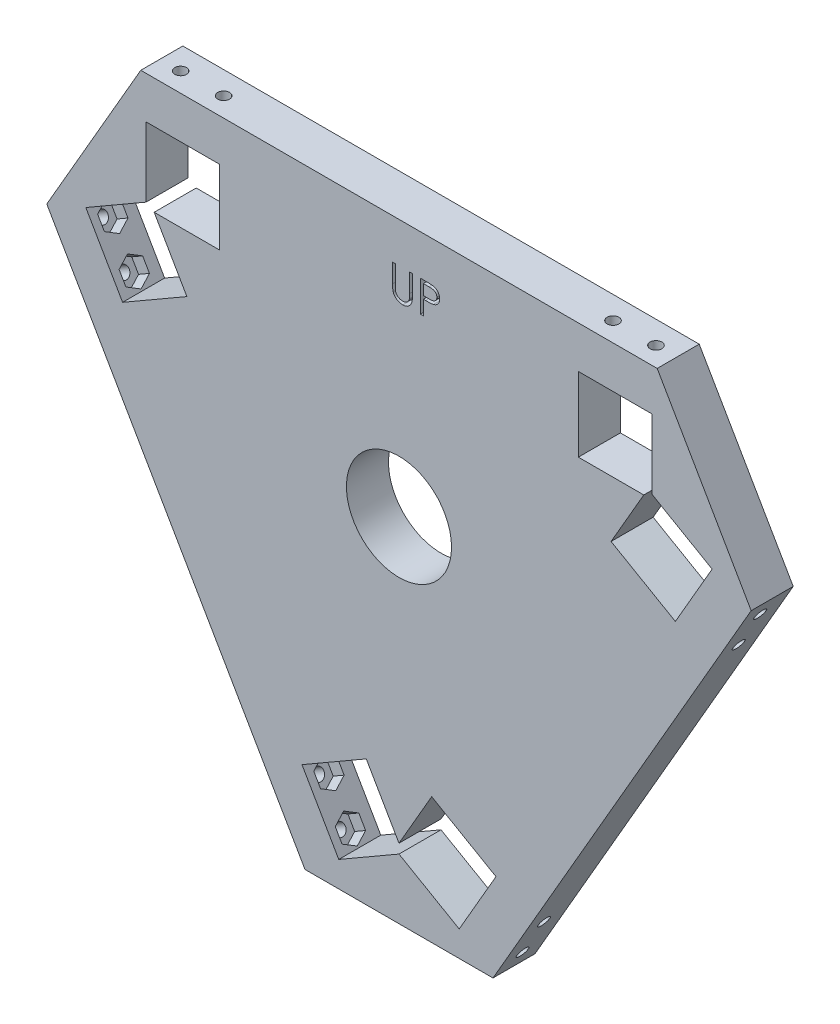
from build123d import *

# Parameters (mm, degrees)
ESBO_O1_R                = 12.5
RESSALTO_EXTRUS_O1_DEPTH = 10
ESBO_O2_R                = 1.4
CORTE_EXTRUS_O1_DEPTH    = 25
CORTE_EXTRUS_O2_START    = -10
CORTE_EXTRUS_O2_DEPTH    = 3
CORTE_EXTRUS_O4_START    = -10
ESBO_O2_6_W              = 10
ESBO_O2_6_H              = 17.5
CORTE_EXTRUS_O4_DEPTH    = 17.66
PADR_OCIRCULAR6_COUNT    = 3
CORTE_EXTRUS_O5_DEPTH    = 2


with BuildPart() as part:
    # Esboço1 → Ressalto-extrusão1 (new body)
    with BuildSketch(Plane.XY):
        Polygon((-61.423008775, 61.28355545), (-83.784620241, 22.552108251), (-22.361611466, -83.835663701), (22.361611466, -83.835663701), (83.784620241, 22.552108251), (61.423008775, 61.28355545), align=None)
        Circle(ESBO_O1_R, mode=Mode.SUBTRACT)
    extrude(amount=RESSALTO_EXTRUS_O1_DEPTH)

    # Esboço2 → Corte-extrusão1 (cut)
    with BuildSketch(Plane(origin=(-53.073115854, -30.641777725, 0), x_dir=(0, 0, 1), z_dir=(-0.8660254037844384, -0.5000000000000006, 0))):
        with Locations((5.4, 56.533008775)):
            Circle(ESBO_O2_R)
        with Locations((5.4, 46.313008775)):
            Circle(ESBO_O2_R)
        with Locations((5.4, -46.313008775)):
            Circle(ESBO_O2_R)
        with Locations((5.4, -56.533008775)):
            Circle(ESBO_O2_R)
    corte_extrus_o1 = extrude(amount=-CORTE_EXTRUS_O1_DEPTH, mode=Mode.SUBTRACT)

    # Esboço2<4> → Corte-extrusão2 (cut)
    with BuildSketch(Plane(origin=(-53.073115854, -30.641777725, 0), x_dir=(0, 0, 1), z_dir=(-0.8660254037844384, -0.5000000000000006, 0)).offset(CORTE_EXTRUS_O2_START)):
        Polygon((8.2, 54.916428021), (8.2, 58.149589529), (5.4, 59.766170282), (2.6, 58.149589529), (2.6, 54.916428021), (5.4, 53.299847267), align=None)
        Polygon((8.2, 44.696428021), (8.2, 47.929589529), (5.4, 49.546170282), (2.6, 47.929589529), (2.6, 44.696428021), (5.4, 43.079847267), align=None)
        Polygon((8.2, -47.929589529), (8.2, -44.696428021), (5.4, -43.079847267), (2.6, -44.696428021), (2.6, -47.929589529), (5.4, -49.546170282), align=None)
        Polygon((8.2, -58.149589529), (8.2, -54.916428021), (5.4, -53.299847267), (2.6, -54.916428021), (2.6, -58.149589529), (5.4, -59.766170282), align=None)
    corte_extrus_o2 = extrude(amount=CORTE_EXTRUS_O2_DEPTH, mode=Mode.SUBTRACT)

    # Esboço2<6> → Corte-extrusão4 (cut)
    with BuildSketch(Plane(origin=(-53.073115854, -30.641777725, 0), x_dir=(0, 0, 1), z_dir=(-0.8660254037844384, -0.5000000000000006, 0)).offset(CORTE_EXTRUS_O4_START)):
        with Locations((5, 51.423008775)):
            Rectangle(ESBO_O2_6_W, ESBO_O2_6_H)
        with Locations((5, -51.423008775)):
            Rectangle(ESBO_O2_6_W, ESBO_O2_6_H)
    corte_extrus_o4 = extrude(amount=-CORTE_EXTRUS_O4_DEPTH, mode=Mode.SUBTRACT)

    # PadrãoCircular6: Corte-extrusão1, Corte-extrusão2, Corte-extrusão4 ×3 about axis
    padr_ocircular6_axis = Axis((0, 0, 10), (0, 0, 1))
    add([corte_extrus_o1.rotate(padr_ocircular6_axis, i * 360 / PADR_OCIRCULAR6_COUNT) for i in range(1, PADR_OCIRCULAR6_COUNT)], mode=Mode.SUBTRACT)
    add([corte_extrus_o2.rotate(padr_ocircular6_axis, i * 360 / PADR_OCIRCULAR6_COUNT) for i in range(1, PADR_OCIRCULAR6_COUNT)], mode=Mode.SUBTRACT)
    add([corte_extrus_o4.rotate(padr_ocircular6_axis, i * 360 / PADR_OCIRCULAR6_COUNT) for i in range(1, PADR_OCIRCULAR6_COUNT)], mode=Mode.SUBTRACT)

    # Esboço3 → Corte-extrusão5 (cut)
    # profile 1 of 2: a face of its own
    with BuildSketch(Plane.XY.offset(10)):
        with BuildLine():
            Line((-1.52797783, 51.712311165), (-0.863127403, 51.712311165))
            Line((-0.863127403, 51.712311165), (-0.863127403, 47.273544138))
            add(Edge.make_bspline(
                [(-0.863127403, 47.273544138), (-0.863226344, 47.210719914), (-0.863414103, 47.091500122), (-0.862159948, 46.921810553), (-0.858647619, 46.770950515), (-0.856433248, 46.638338496), (-0.851507058, 46.524583014), (-0.847489526, 46.429067773), (-0.842323681, 46.352245044), (-0.836115249, 46.307412084), (-0.83344658, 46.288140826)],
                knots=[0, 0, 0, 0, 1.528628734, 2.90083645, 4.128790002, 5.200304208, 6.127813768, 6.898992206, 7.526736466, 8, 8, 8, 8], degree=3))
            add(Edge.make_bspline(
                [(-0.83344658, 46.288140826), (-0.822487626, 46.218615177), (-0.801187215, 46.0834814), (-0.746902382, 45.89105887), (-0.671088671, 45.717637284), (-0.581250898, 45.557805051), (-0.462860204, 45.416010905), (-0.321036054, 45.285387907), (-0.149209777, 45.171147587), (0.041841838, 45.066688369), (0.247762258, 44.982730611), (0.458182771, 44.919244657), (0.669940411, 44.880554319), (0.811706627, 44.876074311), (0.882104969, 44.873849627)],
                knots=[0, 0, 0, 0, 1.035780045, 2.013197591, 2.933192213, 3.817615948, 4.702609284, 5.640816605, 6.646850145, 7.73207398, 8.84249596, 9.914020372, 10.964143139, 12, 12, 12, 12], degree=3))
            add(Edge.make_bspline(
                [(0.882104969, 44.873849627), (0.942543719, 44.87612261), (1.063072142, 44.880655448), (1.242155754, 44.908725477), (1.416569317, 44.959315008), (1.587174089, 45.024592496), (1.74709034, 45.110841564), (1.896407292, 45.210474841), (2.029680953, 45.327337862), (2.151300382, 45.456666924), (2.257207662, 45.602589501), (2.349009912, 45.761928227), (2.424206463, 45.937081011), (2.461340257, 46.060174538), (2.480417268, 46.12341226)],
                knots=[0, 0, 0, 0, 0.994687771, 1.983630487, 2.973142513, 3.978332533, 4.983357753, 5.956394766, 6.925816176, 7.893390482, 8.871859704, 9.88551698, 10.913711441, 12, 12, 12, 12], degree=3))
            add(Edge.make_bspline(
                [(2.480417268, 46.12341226), (2.486767534, 46.149550076), (2.500918484, 46.207795663), (2.514141396, 46.306265728), (2.527913541, 46.422448215), (2.537469381, 46.557177885), (2.546785297, 46.710003277), (2.552358635, 46.881720522), (2.554934688, 47.071706089), (2.555702361, 47.204288082), (2.556103366, 47.273544138)],
                knots=[0, 0, 0, 0, 0.558680831, 1.244966039, 2.062412453, 2.990489873, 4.051219941, 5.244515665, 6.560634259, 8, 8, 8, 8], degree=3))
            Line((2.556103366, 47.273544138), (2.556103366, 51.712311165))
            Line((2.556103366, 51.712311165), (3.220953794, 51.712311165))
            Line((3.220953794, 51.712311165), (3.220953794, 47.237927151))
            add(Edge.make_bspline(
                [(3.220953794, 47.237927151), (3.220415905, 47.157285582), (3.219366184, 46.999908658), (3.210263297, 46.769294948), (3.195749314, 46.550531137), (3.175242861, 46.343587819), (3.148071205, 46.149205516), (3.117855321, 45.965680423), (3.079375309, 45.794329922), (3.034431277, 45.633817971), (2.983052267, 45.481025301), (2.916501836, 45.3360154), (2.841519978, 45.194379921), (2.752588963, 45.058261091), (2.652658203, 44.92705622), (2.539518812, 44.801561011), (2.416912671, 44.67977003), (2.282801604, 44.564807373), (2.139396325, 44.459379007), (1.987123415, 44.366673725), (1.827152585, 44.288307068), (1.659899668, 44.223799694), (1.485293289, 44.175297126), (1.303329044, 44.139154713), (1.113592752, 44.118618183), (0.984550896, 44.115566098), (0.919205997, 44.114020567)],
                knots=[0, 0, 0, 0, 1.316592851, 2.569410997, 3.76748051, 4.895814652, 5.963796859, 6.97159953, 7.931736103, 8.829262218, 9.692595152, 10.560224239, 11.431080259, 12.30701507, 13.211635791, 14.121146779, 15.063487852, 16.031507147, 17.00238618, 17.966455255, 18.938106653, 19.907068911, 20.888905087, 21.893141452, 22.933117798, 24, 24, 24, 24], degree=3))
            add(Edge.make_bspline(
                [(0.919205997, 44.114020567), (0.84793973, 44.115681653), (0.708115569, 44.118940699), (0.502083326, 44.13761552), (0.304568277, 44.172791121), (0.113484338, 44.217579669), (-0.068566981, 44.279351913), (-0.244024772, 44.351526277), (-0.40988398, 44.440166478), (-0.568835336, 44.53878916), (-0.71663107, 44.649754644), (-0.852303906, 44.770701346), (-0.976077832, 44.899691811), (-1.085866573, 45.038122585), (-1.183489112, 45.184917032), (-1.26758473, 45.340490423), (-1.339791097, 45.504782525), (-1.377058331, 45.618983466), (-1.39589817, 45.676715879)],
                knots=[0, 0, 0, 0, 1.13879206, 2.234305948, 3.301075583, 4.341971843, 5.366689343, 6.369221514, 7.369726634, 8.367512178, 9.355451585, 10.318319045, 11.268648973, 12.207971039, 13.137398894, 14.081662264, 15.030215811, 16, 16, 16, 16], degree=3))
            add(Edge.make_bspline(
                [(-1.39589817, 45.676715879), (-1.406856488, 45.716154829), (-1.430625324, 45.801698788), (-1.45607887, 45.943275189), (-1.477476427, 46.106290098), (-1.497596525, 46.290754673), (-1.509468819, 46.496811891), (-1.519877398, 46.724372429), (-1.528051158, 46.973711448), (-1.528002956, 47.147393506), (-1.52797783, 47.237927151)],
                knots=[0, 0, 0, 0, 0.625038921, 1.35572334, 2.194682327, 3.136881307, 4.189498639, 5.346923369, 6.617055217, 8, 8, 8, 8], degree=3))
            Line((-1.52797783, 47.237927151), (-1.52797783, 51.712311165))
        make_face()
    # profile 2 of 2: a face of its own
    with BuildSketch(Plane.XY.offset(10)):
        with BuildLine():
            Line((5.120526443, 51.712311165), (6.573402712, 51.712311165))
            add(Edge.make_bspline(
                [(6.573402712, 51.712311165), (6.673332463, 51.712201318), (6.864802305, 51.711990846), (7.139365839, 51.705609634), (7.388729771, 51.697086469), (7.612356411, 51.685271462), (7.810933818, 51.671308679), (7.983563436, 51.651725196), (8.131602163, 51.631277571), (8.220304148, 51.610488927), (8.26075748, 51.60100808)],
                knots=[0, 0, 0, 0, 1.415646017, 2.712440637, 3.8905458, 4.950247383, 5.884950622, 6.709939814, 7.411656543, 8, 8, 8, 8], degree=3))
            add(Edge.make_bspline(
                [(8.26075748, 51.60100808), (8.311967126, 51.58699162), (8.413179728, 51.559288979), (8.559020269, 51.503803264), (8.697775909, 51.438012682), (8.829922707, 51.363032009), (8.953836783, 51.275644231), (9.071366903, 51.17939174), (9.181475861, 51.072052254), (9.283544474, 50.954829688), (9.377280629, 50.82969191), (9.457988458, 50.694770857), (9.525567755, 50.552337598), (9.583529013, 50.402491206), (9.625245241, 50.243973354), (9.656671179, 50.07788548), (9.676617858, 49.904245385), (9.67852828, 49.785585332), (9.679500802, 49.725180089)],
                knots=[0, 0, 0, 0, 0.999701418, 1.975846123, 2.934577507, 3.890451536, 4.834027766, 5.787354733, 6.749476667, 7.726910423, 8.712836071, 9.690891519, 10.682875813, 11.679750201, 12.712814741, 13.765529915, 14.8625177, 16, 16, 16, 16], degree=3))
            add(Edge.make_bspline(
                [(9.679500802, 49.725180089), (9.678608786, 49.664267128), (9.676863498, 49.545086806), (9.65591636, 49.370731071), (9.627700788, 49.204110478), (9.584315361, 49.045594475), (9.527492019, 48.896124427), (9.460833841, 48.753416153), (9.380435368, 48.619897514), (9.288053812, 48.495083782), (9.18528627, 48.378857801), (9.072567551, 48.272061819), (8.950352716, 48.17532097), (8.819030169, 48.088418376), (8.677319655, 48.013369251), (8.52737043, 47.946149622), (8.367879139, 47.889695877), (8.257510818, 47.859998913), (8.201395834, 47.844899974)],
                knots=[0, 0, 0, 0, 1.121902311, 2.195077645, 3.232258892, 4.234102512, 5.217864754, 6.176164875, 7.132989551, 8.084763148, 9.034132444, 9.988522005, 10.94243251, 11.903244335, 12.886203696, 13.894208494, 14.929344452, 16, 16, 16, 16], degree=3))
            add(Edge.make_bspline(
                [(8.201395834, 47.844899974), (8.154982977, 47.835029997), (8.053266503, 47.81339937), (7.885747741, 47.789251469), (7.690706674, 47.768640215), (7.468409515, 47.75318614), (7.219055799, 47.739956193), (6.942510638, 47.729440395), (6.638231175, 47.723662204), (6.425990375, 47.723364193), (6.315179555, 47.723208601)],
                knots=[0, 0, 0, 0, 0.601384939, 1.31797006, 2.144135048, 3.087295005, 4.142315834, 5.309527816, 6.595305764, 8, 8, 8, 8], degree=3))
            Line((6.315179555, 47.723208601), (5.785376871, 47.723208601))
            Line((5.785376871, 47.723208601), (5.785376871, 44.303977832))
            Line((5.785376871, 44.303977832), (5.120526443, 44.303977832))
            Line((5.120526443, 44.303977832), (5.120526443, 51.712311165))
        make_face()
        with BuildLine():
            Line((5.785376871, 50.952482105), (5.785376871, 48.483037661))
            Line((5.785376871, 48.483037661), (7.08242882, 48.466713208))
            add(Edge.make_bspline(
                [(7.08242882, 48.466713208), (7.14575933, 48.466680477), (7.268017573, 48.46661729), (7.444624246, 48.47505268), (7.608473904, 48.484790474), (7.759063255, 48.499048179), (7.896460183, 48.519201507), (8.020893786, 48.539546352), (8.131399201, 48.56897937), (8.260725845, 48.608609866), (8.404835597, 48.676200569), (8.561611908, 48.774307837), (8.694476316, 48.899362002), (8.809450044, 49.039967579), (8.900690819, 49.196387402), (8.967484336, 49.363749985), (9.006729786, 49.540338933), (9.011992229, 49.661175494), (9.014650375, 49.722212007)],
                knots=[0, 0, 0, 0, 1.160613943, 2.240541288, 3.23993089, 4.169200891, 5.011653406, 5.7853311, 6.478053781, 7.106038997, 8.262395093, 9.384106736, 10.481365981, 11.59014053, 12.70357646, 13.786202915, 14.881775077, 16, 16, 16, 16], degree=3))
            add(Edge.make_bspline(
                [(9.014650375, 49.722212007), (9.011977773, 49.78177186), (9.006664972, 49.900169477), (8.967176728, 50.073691187), (8.90082068, 50.239290095), (8.808837555, 50.393749792), (8.697202163, 50.533849427), (8.567451887, 50.655551679), (8.419892151, 50.753387617), (8.282630062, 50.81653473), (8.160707551, 50.855090396), (8.054806569, 50.882066975), (7.935234642, 50.903605342), (7.801952842, 50.921045623), (7.65599421, 50.935975449), (7.496104777, 50.946105767), (7.322890232, 50.952035516), (7.20264119, 50.952329638), (7.140306424, 50.952482105)],
                knots=[0, 0, 0, 0, 1.120700087, 2.227813068, 3.331159281, 4.466773991, 5.599788987, 6.693661531, 7.80175334, 8.91857717, 9.525282508, 10.207424825, 10.974604443, 11.810962634, 12.737642355, 13.736264703, 14.826523623, 16, 16, 16, 16], degree=3))
            Line((7.140306424, 50.952482105), (5.785376871, 50.952482105))
        make_face(mode=Mode.SUBTRACT)
    extrude(amount=-CORTE_EXTRUS_O5_DEPTH, mode=Mode.SUBTRACT)


solid = part.part
